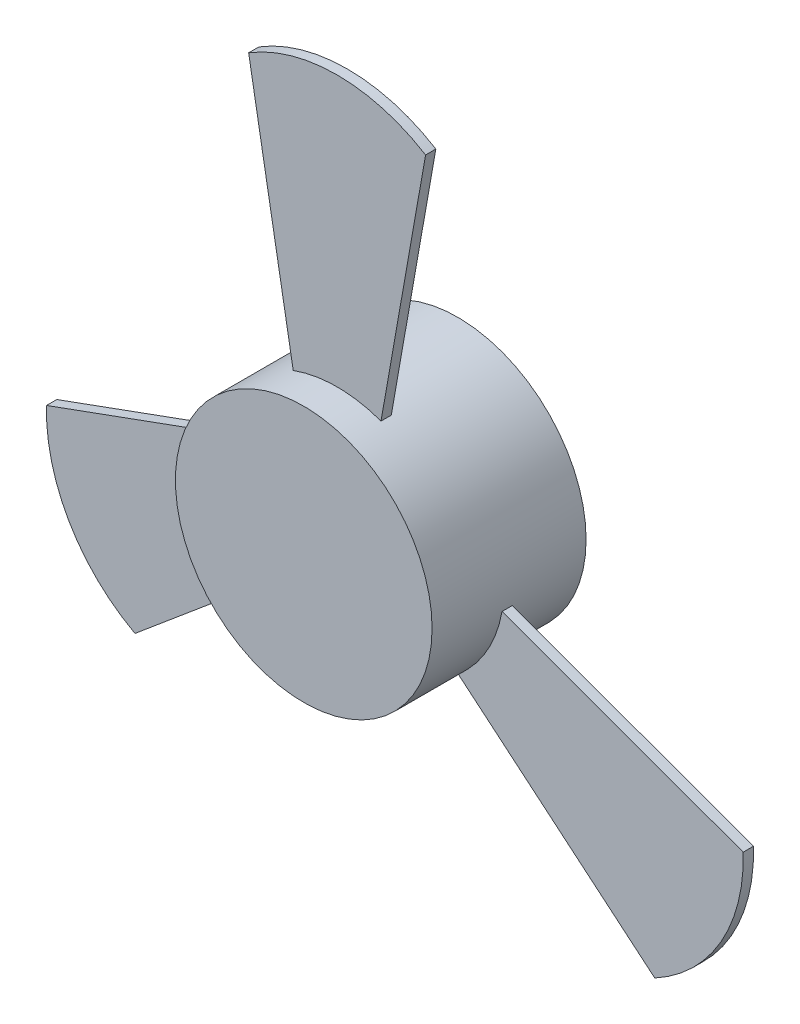
from build123d import *

# Parameters (mm, degrees)
SKETCH1_R           = 50
BOSS_EXTRUDE1_DEPTH = 60
BOSS_EXTRUDE4_DEPTH = 2
BOSS_EXTRUDE5_DEPTH = 2
BOSS_EXTRUDE6_DEPTH = 2


with BuildPart() as part:
    # Sketch1 → Boss-Extrude1 (new body)
    with BuildSketch(Plane.XY):
        Circle(SKETCH1_R)
    extrude(amount=BOSS_EXTRUDE1_DEPTH)

    # Sketch4 → Boss-Extrude4 (add, symmetric)
    with BuildSketch(Plane(origin=(0, 0, 45), x_dir=(-1, 0, 0), z_dir=(0, 0, -1))):
        with BuildLine():
            Line((-17.101007166, 46.984631039), (-34.465824933, 145.465406341))
            ThreePointArc((-34.465824933, 145.465406341), (0, 155.249311955), (34.465824933, 145.465406341))
            Line((34.465824933, 145.465406341), (17.101007166, 46.984631039))
            ThreePointArc((17.101007166, 46.984631039), (0, 50), (-17.101007166, 46.984631039))
        make_face()
    extrude(amount=BOSS_EXTRUDE4_DEPTH, both=True)

    # Sketch5 → Boss-Extrude5 (add, symmetric)
    with BuildSketch(Plane(origin=(0, 0, 30), x_dir=(-1, 0, 0), z_dir=(0, 0, -1))):
        with BuildLine():
            Line((-32.139380484, -38.302222156), (-108.743824796, -102.580983125))
            ThreePointArc((-108.743824796, -102.580983125), (-134.449848073, -77.624655977), (-143.209649729, -42.884423216))
            Line((-143.209649729, -42.884423216), (-49.240387651, -8.682408883))
            ThreePointArc((-49.240387651, -8.682408883), (-43.301270189, -25), (-32.139380484, -38.302222156))
        make_face()
    extrude(amount=BOSS_EXTRUDE5_DEPTH, both=True)

    # Sketch6 → Boss-Extrude6 (add, symmetric)
    with BuildSketch(Plane(origin=(0, 0, 15), x_dir=(-1, 0, 0), z_dir=(0, 0, -1))):
        with BuildLine():
            Line((49.240387651, -8.682408883), (143.209649729, -42.884423216))
            ThreePointArc((143.209649729, -42.884423216), (134.449848073, -77.624655977), (108.743824796, -102.580983125))
            Line((108.743824796, -102.580983125), (32.139380484, -38.302222156))
            ThreePointArc((32.139380484, -38.302222156), (43.301270189, -25), (49.240387651, -8.682408883))
        make_face()
    extrude(amount=BOSS_EXTRUDE6_DEPTH, both=True)


solid = part.part
